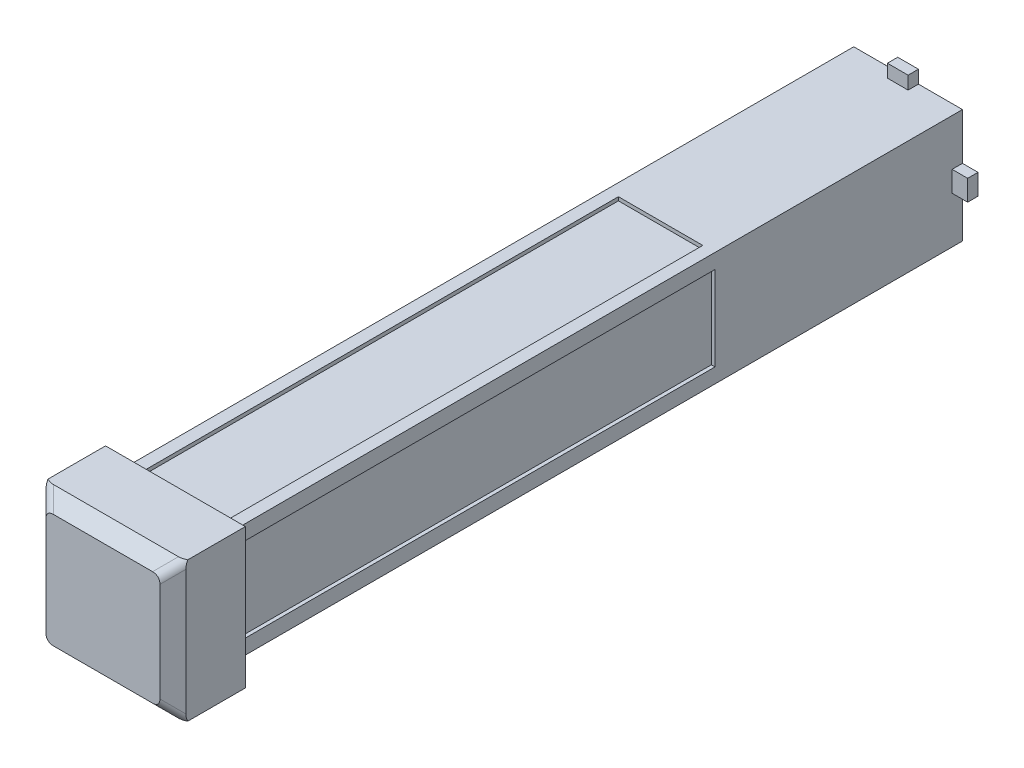
from build123d import *

# Parameters (mm, degrees)
SKETCH1_W           = 210
SKETCH1_H           = 220
BOSS_EXTRUDE1_DEPTH = 1555
SKETCH2_W           = 937
SKETCH2_H           = 163
CUT_EXTRUDE1_DEPTH  = 7
SKETCH4_W           = 163
SKETCH4_H           = 937
CUT_EXTRUDE2_DEPTH  = 7
SKETCH5_W           = 270
SKETCH5_H           = 270
BOSS_EXTRUDE2_DEPTH = 140
CHAMFER1_SIZE       = 25
FILLET1_R           = 20
BOSS_EXTRUDE3_DEPTH = 20


with BuildPart() as part:
    # Sketch1 → Boss-Extrude1 (new body)
    with BuildSketch(Plane.XY):
        Rectangle(SKETCH1_W, SKETCH1_H)
    extrude(amount=BOSS_EXTRUDE1_DEPTH)

    # Sketch2 → Cut-Extrude1 (cut)
    with BuildSketch(Plane.ZY.offset(105)):
        with Locations((946.5, 0)):
            Rectangle(SKETCH2_W, SKETCH2_H)
    cut_extrude1 = extrude(amount=-CUT_EXTRUDE1_DEPTH, mode=Mode.SUBTRACT)

    # Mirror2: Cut-Extrude1 across plane
    add(cut_extrude1.mirror(Plane(origin=(0, 0, 0), x_dir=(0, 0, 1), z_dir=(1, 0, 0))), mode=Mode.SUBTRACT)

    # Sketch4 → Cut-Extrude2 (cut)
    with BuildSketch(Plane(origin=(0, 110, 0), x_dir=(1, 0, 0), z_dir=(0, 1, 0))):
        with Locations((0, -946.5)):
            Rectangle(SKETCH4_W, SKETCH4_H)
    cut_extrude2 = extrude(amount=-CUT_EXTRUDE2_DEPTH, mode=Mode.SUBTRACT)

    # Mirror3: Cut-Extrude2 across plane
    add(cut_extrude2.mirror(Plane.ZX), mode=Mode.SUBTRACT)

    # Sketch5 → Boss-Extrude2 (add)
    with BuildSketch(Plane.XY.offset(1555)):
        Rectangle(SKETCH5_W, SKETCH5_H)
    extrude(amount=-BOSS_EXTRUDE2_DEPTH)

    # Chamfer1
    chamfer1_edges = [part.edges().sort_by_distance(p)[0] for p in [
        (-135, 0, 1555),
        (0, -135, 1555),
        (135, 0, 1555),
        (0, 135, 1555),
    ]]
    chamfer(chamfer1_edges, length=CHAMFER1_SIZE)

    # Fillet1
    fillet1_edges = [part.edges().sort_by_distance(p)[0] for p in [
        (-122.5, 122.5, 1542.5),
        (122.5, 122.5, 1542.5),
        (122.5, -122.5, 1542.5),
        (-122.5, -122.5, 1542.5),
    ]]
    fillet(fillet1_edges, radius=FILLET1_R)

    # Sketch6 → Boss-Extrude3 (add)
    with BuildSketch(Plane(origin=(0, 0, 0), x_dir=(-1, 0, 0), z_dir=(0, 0, -1))):
        Polygon((-20, 135), (20, 135), (20, 20), (135, 20), (135, -20), (20, -20), (20, -135), (-20, -135), (-20, -20), (-135, -20), (-135, 20), (-20, 20), align=None)
    extrude(amount=-BOSS_EXTRUDE3_DEPTH)


solid = part.part
